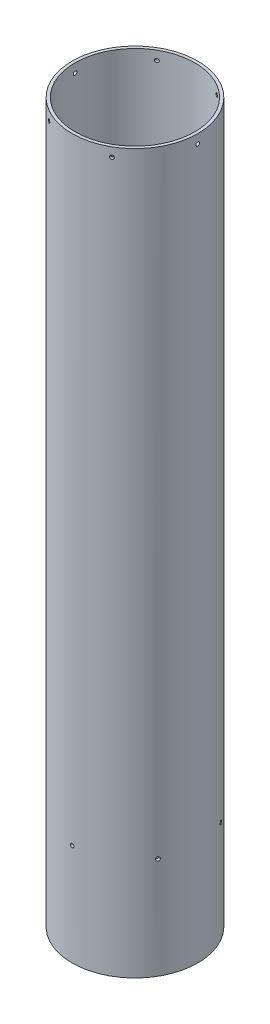
from build123d import *

# Parameters (mm, degrees)
SKETCH1_R               = 105
SKETCH1_R_2             = 100
BOSS_EXTRUDE1_DEPTH     = 1200
CUT_EXTRUDE1_REACH      = 1211.153
CUT_EXTRUDE1_END_RADIUS = 105
SKETCH2_R               = 3.05
CIRPATTERN1_COUNT       = 6
SKETCH3_R               = 3.05
CUT_EXTRUDE2_DEPTH      = 1210.152595946
CIRPATTERN2_COUNT       = 6


with BuildPart() as part:
    # Sketch1 → Boss-Extrude1 (new body)
    with BuildSketch(Plane(origin=(0, 0, 0), x_dir=(1, 0, 0), z_dir=(0, 1, 0))):
        with Locations(Location((0, 0, 0), (0, 0, 270))):
            Circle(SKETCH1_R)
        with Locations(Location((0, 0, 0), (0, 0, 270))):
            Circle(SKETCH1_R_2, mode=Mode.SUBTRACT)
    extrude(amount=BOSS_EXTRUDE1_DEPTH)

    # Cut-Extrude1: up to this cylinder (the profile starts inside it)
    cut_extrude1_end = Plane(origin=(0, 1185, 0), z_dir=(0, -1, 0)) * Cylinder(CUT_EXTRUDE1_END_RADIUS, 2633.306, mode=Mode.PRIVATE)
    # Sketch2 → Cut-Extrude1 (cut, up to the surface)
    with BuildSketch(Plane(origin=(0, 0, 0), x_dir=(0, 0, -1), z_dir=(1, 0, 0)), mode=Mode.PRIVATE) as cut_extrude1_sk1:
        with Locations((0, 1185)):
            Circle(SKETCH2_R)
    cut_extrude1_tool1 = extrude(cut_extrude1_sk1.sketch, amount=-CUT_EXTRUDE1_REACH, mode=Mode.PRIVATE) & cut_extrude1_end
    cut_extrude1 = cut_extrude1_tool1.solids().sort_by_distance((0, 1185, 0))[0]
    add(cut_extrude1, mode=Mode.SUBTRACT)

    # CirPattern1: Cut-Extrude1 ×6 about axis
    cirpattern1_axis = Axis((0, 1200, 0), (0, 1, 0))
    for i in range(1, CIRPATTERN1_COUNT):
        add(cut_extrude1.rotate(cirpattern1_axis, i * 360 / CIRPATTERN1_COUNT), mode=Mode.SUBTRACT)

    # Sketch3 → Cut-Extrude2 (cut, through all)
    with BuildSketch(Plane.XY):
        with Locations(Location((0, 170, 0), (0, 0, 90))):
            Circle(SKETCH3_R)
    cut_extrude2 = extrude(amount=-CUT_EXTRUDE2_DEPTH, mode=Mode.SUBTRACT)

    # CirPattern2: Cut-Extrude2 ×6 about axis
    cirpattern2_axis = Axis((0, 0, 0), (0, 1, 0))
    for i in range(1, CIRPATTERN2_COUNT):
        add(cut_extrude2.rotate(cirpattern2_axis, i * 360 / CIRPATTERN2_COUNT), mode=Mode.SUBTRACT)


solid = part.part
